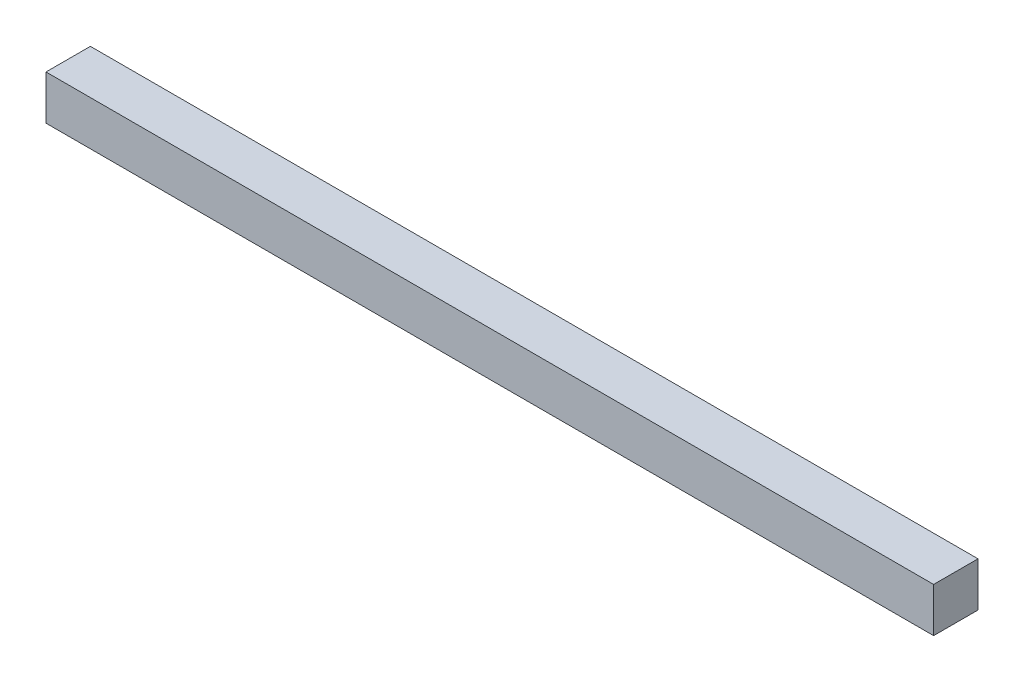
from build123d import *

# Parameters (mm, degrees)
SKETCH1_W           = 20
SKETCH1_H           = 20
BOSS_EXTRUDE1_DEPTH = 400


with BuildPart() as part:
    # Sketch1 → Boss-Extrude1 (new body)
    with BuildSketch(Plane(origin=(0, 0, 0), x_dir=(0, 0, -1), z_dir=(1, 0, 0))):
        Rectangle(SKETCH1_W, SKETCH1_H)
    extrude(amount=BOSS_EXTRUDE1_DEPTH)


solid = part.part
